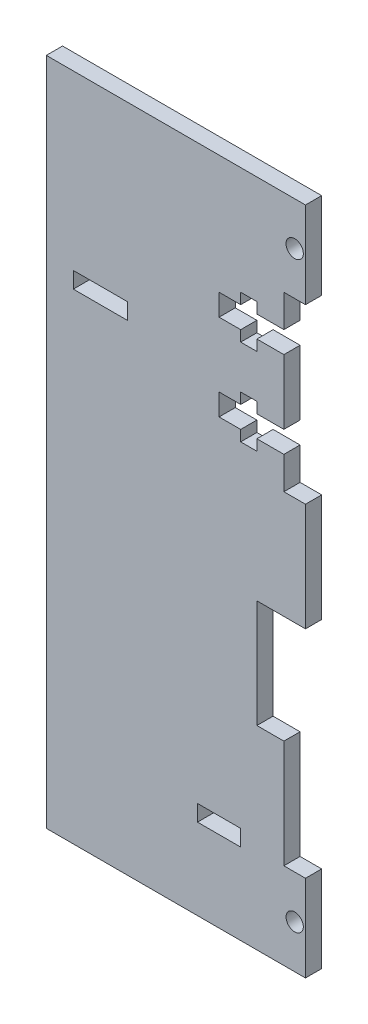
from build123d import *

# Parameters (mm, degrees)
SKETCH_1_W      = 8
SKETCH_1_H      = 3
SKETCH_1_R      = 1.6
EXTRUDE_1_DEPTH = 3


with BuildPart() as part:
    # 草图1 → 凸台-拉伸1 (new body)
    with BuildSketch(Plane.XY):
        Polygon((0, 140), (0, 146), (4, 146), (4, 162), (0, 162), (-44, 162), (-44, 38), (4, 38), (4, 54), (0, 54), (0, 74), (-5, 74), (-5, 94), (4, 94), (4, 114), (0, 114), (0, 120), (-5, 120), (-5, 118), (-8, 118), (-8, 120), (-12, 120), (-12, 124), (-8, 124), (-8, 126), (-5, 126), (-5, 124), (0, 124), (0, 136), (-5, 136), (-5, 134), (-8, 134), (-8, 136), (-12, 136), (-12, 140), (-8, 140), (-8, 142), (-5, 142), (-5, 140), align=None)
        with Locations((-12, 54.5)):
            Rectangle(SKETCH_1_W, SKETCH_1_H, mode=Mode.SUBTRACT)
        with Locations((2, 46)):
            Circle(SKETCH_1_R, mode=Mode.SUBTRACT)
        Polygon((-39, 130), (-32, 130), (-29, 130), (-29, 127), (-39, 127), align=None, mode=Mode.SUBTRACT)
        with Locations((2, 154)):
            Circle(SKETCH_1_R, mode=Mode.SUBTRACT)
    extrude(amount=EXTRUDE_1_DEPTH)


solid = part.part
